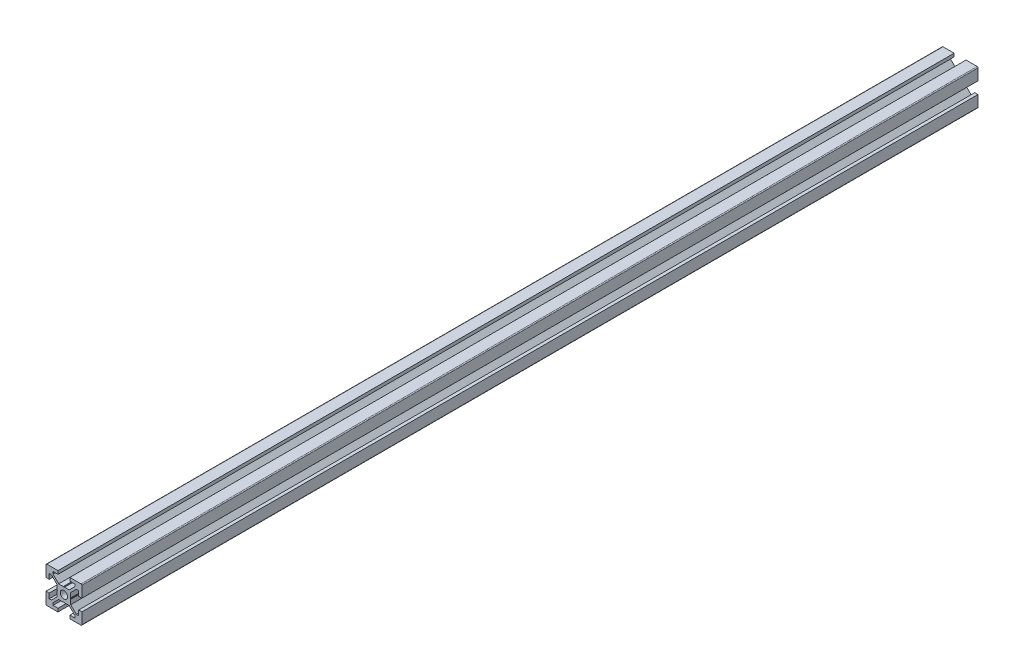
from build123d import *

# Parameters (mm, degrees)
SKETCH1_R           = 2.05
BOSS_EXTRUDE1_DEPTH = 500
FILLET1_R           = 0.5


with BuildPart() as part:
    # Sketch1 → Boss-Extrude1 (new body)
    with BuildSketch(Plane.XY):
        Polygon((-3.3, 10), (-3.3, 8.2), (-6.08, 8.2), (-6.08, 6.928528137), (-2.931471863, 3.78), (-0.34, 3.78), (0, 3.66), (0.34, 3.78), (2.931471863, 3.78), (6.08, 6.928528137), (6.08, 8.2), (3.3, 8.2), (3.3, 10), (10, 10), (10, 3.3), (8.2, 3.3), (8.2, 6.08), (6.928528137, 6.08), (3.78, 2.931471863), (3.78, 0.34), (3.66, 0), (3.78, -0.34), (3.78, -2.931471863), (6.928528137, -6.08), (8.2, -6.08), (8.2, -3.3), (10, -3.3), (10, -10), (3.3, -10), (3.3, -8.2), (6.08, -8.2), (6.08, -6.928528137), (2.931471863, -3.78), (0.34, -3.78), (0, -3.66), (-0.34, -3.78), (-2.931471863, -3.78), (-6.08, -6.928528137), (-6.08, -8.2), (-3.3, -8.2), (-3.3, -10), (-10, -10), (-10, -3.3), (-8.2, -3.3), (-8.2, -6.08), (-6.928528137, -6.08), (-3.78, -2.931471863), (-3.78, -0.34), (-3.66, 0), (-3.78, 0.34), (-3.78, 2.931471863), (-6.928528137, 6.08), (-8.2, 6.08), (-8.2, 3.3), (-10, 3.3), (-10, 10), align=None)
        Circle(SKETCH1_R, mode=Mode.SUBTRACT)
    extrude(amount=BOSS_EXTRUDE1_DEPTH)

    # Fillet1
    fillet1_edges = [part.edges().sort_by_distance(p)[0] for p in [
        (10, 10, 250),
        (10, -10, 250),
        (-10, -10, 250),
        (-10, 10, 250),
    ]]
    fillet(fillet1_edges, radius=FILLET1_R)


solid = part.part
